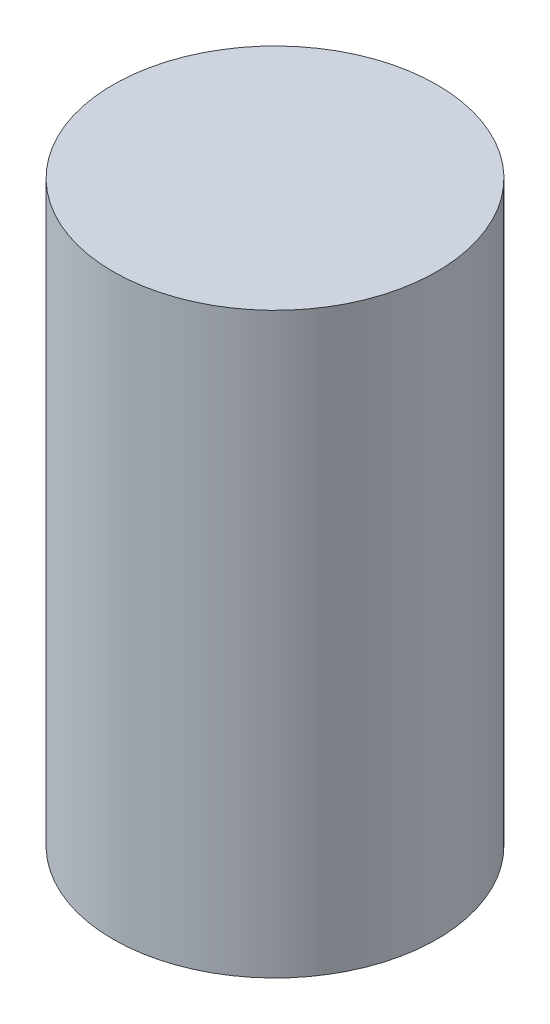
from build123d import *

# Parameters (mm, degrees)
SKETCH1_R           = 10.668
BOSS_EXTRUDE1_DEPTH = 38.1


with BuildPart() as part:
    # Sketch1 → Boss-Extrude1 (new body)
    with BuildSketch(Plane(origin=(0, 0, 0), x_dir=(1, 0, 0), z_dir=(0, 1, 0))):
        with Locations(Location((0, 0, 0), (0, 0, 90))):
            Circle(SKETCH1_R)
    extrude(amount=BOSS_EXTRUDE1_DEPTH)


solid = part.part
